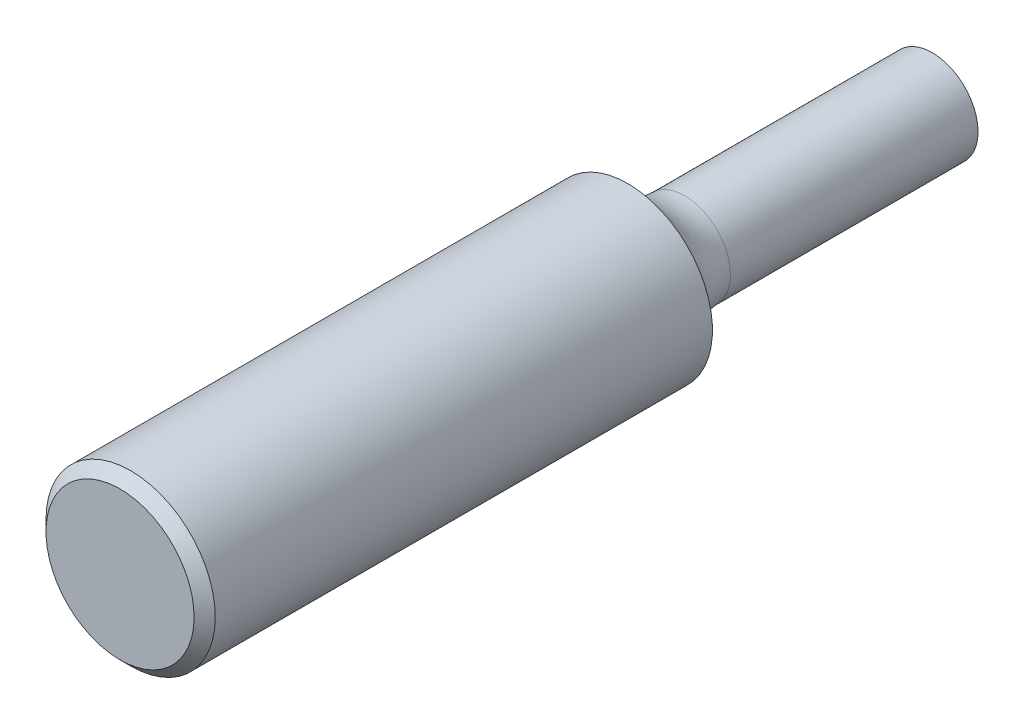
from build123d import *

# Parameters (mm, degrees)
CHAFL_N1_SIZE = 0.396875


with BuildPart() as part:
    # Croquis1 → Revolución1 (revolve)
    with BuildSketch(Plane(origin=(0, 0, 0), x_dir=(0, 0, -1), z_dir=(1, 0, 0)), mode=Mode.PRIVATE) as revoluci_n1_sk:
        with BuildLine():
            Line((-15.24, 0), (-15.24, 3.175))
            Line((-15.24, 3.175), (3.81, 3.175))
            ThreePointArc((3.81, 3.175), (4.64971325, 2.114646215), (5.941747112, 1.7145))
            Line((5.941747112, 1.7145), (15.24, 1.7145))
            Line((15.24, 1.7145), (15.24, 0))
            Line((15.24, 0), (-15.24, 0))
        make_face()
    revolve(revoluci_n1_sk.sketch.rotate(Axis((0, 0, -127), (0, 0, 1)), 90), axis=Axis((0, 0, -127), (0, 0, 1)))

    # Croquis4 → Cortar-Revolución1 (revolve, cut)
    with BuildSketch(Plane(origin=(0, 0, 0), x_dir=(0, 0, -1), z_dir=(1, 0, 0)), mode=Mode.PRIVATE) as cortar_revoluci_n1_sk:
        with BuildLine():
            ThreePointArc((15.24, 1.722711816), (14.861646983, 0.898025612), (14.732, 0))
            Line((14.732, 0), (15.24, 0))
            Line((15.24, 0), (15.24, 1.722711816))
        make_face()
        with BuildLine():
            ThreePointArc((14.732, 0), (14.861646983, 0.898025612), (15.24, 1.722711816))
            Line((15.24, 1.722711816), (15.24, 0))
            Line((15.24, 0), (14.732, 0))
        make_face()
    revolve(cortar_revoluci_n1_sk.sketch.rotate(Axis((0, 0, -15.24), (0, 0, 1)), 90), axis=Axis((0, 0, -15.24), (0, 0, 1)), mode=Mode.SUBTRACT)

    # Chaflán1
    chafl_n1_edges = [part.edges().sort_by_distance(p)[0] for p in [
        (3.175, 0, 15.24),
    ]]
    chamfer(chafl_n1_edges, length=CHAFL_N1_SIZE)


solid = part.part
